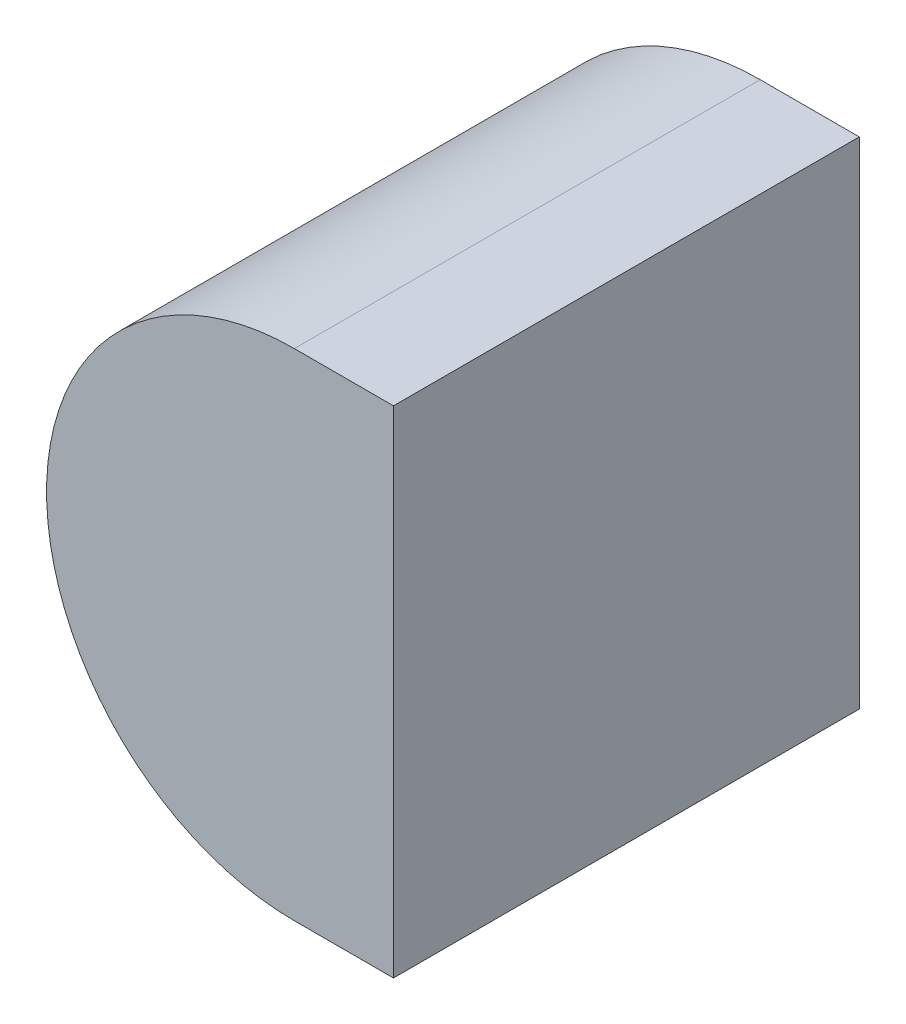
from build123d import *

# Parameters (mm, degrees)
BOSS_EXTRUDE1_DEPTH = 4.7


with BuildPart() as part:
    # Sketch1 → Boss-Extrude1 (new body)
    with BuildSketch(Plane.XY):
        with BuildLine():
            Line((458.461656421, 7.201310859), (457.461656421, 7.201310859))
            ThreePointArc((457.461656421, 7.201310859), (454.961656421, 4.701310859), (457.461656421, 2.201310859))
            Line((457.461656421, 2.201310859), (458.461656421, 2.201310859))
            Line((458.461656421, 2.201310859), (458.461656421, 7.201310859))
        make_face()
    extrude(amount=BOSS_EXTRUDE1_DEPTH)


solid = part.part
